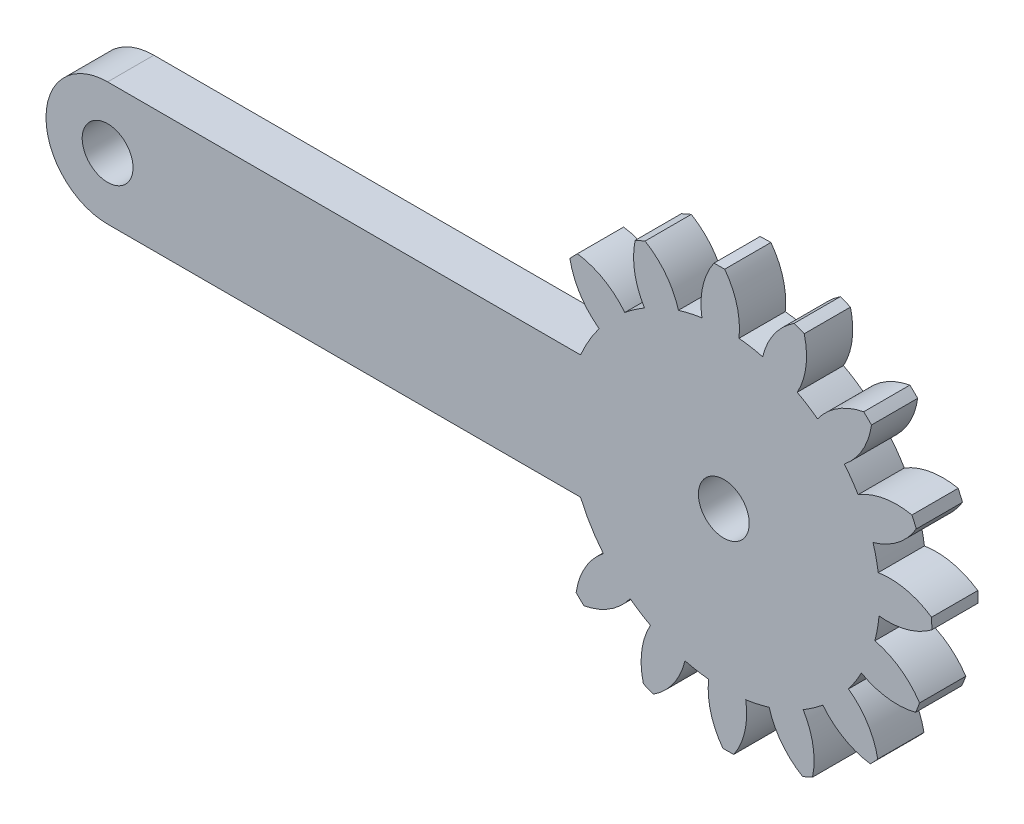
from build123d import *

# Parameters (mm, degrees)
SKETCH1_R           = 1.65
BOSS_EXTRUDE1_DEPTH = 3


with BuildPart() as part:
    # Sketch1 → Boss-Extrude1 (new body)
    with BuildSketch(Plane.XY):
        with BuildLine():
            ThreePointArc((-20.755142163, -16.478801884), (-21.932583818, -17.847935828), (-22.52081897, -19.555236625))
            ThreePointArc((-22.52081897, -19.555236625), (-22.269390429, -19.802297923), (-22.01159712, -20.042710497))
            ThreePointArc((-22.01159712, -20.042710497), (-20.331579752, -19.3805638), (-19.015108204, -18.144522024))
            ThreePointArc((-19.015108204, -18.144522024), (-18.373585411, -18.588879433), (-17.699741584, -18.98250298))
            ThreePointArc((-17.699741584, -18.98250298), (-18.263610953, -20.698005222), (-18.153713641, -22.500453331))
            ThreePointArc((-18.153713641, -22.500453331), (-17.826877693, -22.63249067), (-17.496705822, -22.755949699))
            ThreePointArc((-17.496705822, -22.755949699), (-16.197964732, -21.501291105), (-15.454716323, -19.855545556))
            ThreePointArc((-15.454716323, -19.855545556), (-14.691978327, -20.020578127), (-13.918794597, -20.126369997))
            ThreePointArc((-13.918794597, -20.126369997), (-13.78324768, -21.927070872), (-12.991948773, -23.550259908))
            ThreePointArc((-12.991948773, -23.550259908), (-12.639463228, -23.547171801), (-12.287178469, -23.534881765))
            ThreePointArc((-12.287178469, -23.534881765), (-11.567435216, -21.878721672), (-11.510562778, -20.073822192))
            ThreePointArc((-11.510562778, -20.073822192), (-10.742729525, -19.934405211), (-9.987916106, -19.736259551))
            ThreePointArc((-9.987916106, -19.736259551), (-9.173588692, -21.348018674), (-7.821356276, -22.544832821))
            ThreePointArc((-7.821356276, -22.544832821), (-7.496883863, -22.407089403), (-7.176118378, -22.260921351))
            ThreePointArc((-7.176118378, -22.260921351), (-7.144947346, -20.455395119), (-7.783109193, -18.766121291))
            ThreePointArc((-7.783109193, -18.766121291), (-7.127076334, -18.343479732), (-6.505546727, -17.871562422))
            ThreePointArc((-6.505546727, -17.871562422), (-5.136412783, -19.049004077), (-3.429111986, -19.637239229))
            ThreePointArc((-3.429111986, -19.637239229), (-3.182050688, -19.385810688), (-2.941638114, -19.128017379))
            ThreePointArc((-2.941638114, -19.128017379), (-3.603784812, -17.448000011), (-4.839826587, -16.131528463))
            ThreePointArc((-4.839826587, -16.131528463), (-4.395469179, -15.49000567), (-4.001845631, -14.816161843))
            ThreePointArc((-4.001845631, -14.816161843), (-2.286343389, -15.380031212), (-0.48389528, -15.2701339))
            ThreePointArc((-0.48389528, -15.2701339), (-0.351857941, -14.943297952), (-0.228398912, -14.613126081))
            ThreePointArc((-0.228398912, -14.613126081), (-1.483057507, -13.314384991), (-3.128803055, -12.571136582))
            ThreePointArc((-3.128803055, -12.571136582), (-2.963770485, -11.808398586), (-2.857978614, -11.035214856))
            ThreePointArc((-2.857978614, -11.035214856), (-1.05727774, -10.899667939), (0.565911297, -10.108369033))
            ThreePointArc((0.565911297, -10.108369033), (0.56282319, -9.755883487), (0.550533154, -9.403598729))
            ThreePointArc((0.550533154, -9.403598729), (-1.105626939, -8.683855475), (-2.910526419, -8.626983037))
            ThreePointArc((-2.910526419, -8.626983037), (-3.0499434, -7.859149784), (-3.24808906, -7.104336365))
            ThreePointArc((-3.24808906, -7.104336365), (-1.636329937, -6.290008951), (-0.43951579, -4.937776535))
            ThreePointArc((-0.43951579, -4.937776535), (-0.577259208, -4.613304122), (-0.723427261, -4.292538637))
            ThreePointArc((-0.723427261, -4.292538637), (-2.528953492, -4.261367605), (-4.21822732, -4.899529452))
            ThreePointArc((-4.21822732, -4.899529452), (-4.64086888, -4.243496594), (-5.112786189, -3.621966986))
            ThreePointArc((-5.112786189, -3.621966986), (-3.935344534, -2.252833042), (-3.347109382, -0.545532245))
            ThreePointArc((-3.347109382, -0.545532245), (-3.598537923, -0.298470947), (-3.856331232, -0.058058373))
            ThreePointArc((-3.856331232, -0.058058373), (-5.5363486, -0.720205071), (-6.852820148, -1.956246846))
            ThreePointArc((-6.852820148, -1.956246846), (-7.494342941, -1.511889438), (-8.168186768, -1.11826589))
            ThreePointArc((-8.168186768, -1.11826589), (-7.604317399, 0.597236351), (-7.714214711, 2.399684461))
            ThreePointArc((-7.714214711, 2.399684461), (-8.041050659, 2.5317218), (-8.37122253, 2.655180829))
            ThreePointArc((-8.37122253, 2.655180829), (-9.66996362, 1.400522234), (-10.413212029, -0.245223314))
            ThreePointArc((-10.413212029, -0.245223314), (-11.175950025, -0.080190744), (-11.949133755, 0.025601127))
            ThreePointArc((-11.949133755, 0.025601127), (-12.084680673, 1.826302001), (-12.875979579, 3.449491038))
            ThreePointArc((-12.875979579, 3.449491038), (-13.228465124, 3.44640293), (-13.580749883, 3.434112895))
            ThreePointArc((-13.580749883, 3.434112895), (-14.300493136, 1.777952801), (-14.357365574, -0.026946679))
            ThreePointArc((-14.357365574, -0.026946679), (-15.125198828, -0.166363659), (-15.880012246, -0.364509319))
            ThreePointArc((-15.880012246, -0.364509319), (-16.69433966, 1.247249804), (-18.046572076, 2.444063951))
            ThreePointArc((-18.046572076, 2.444063951), (-18.371044489, 2.306320533), (-18.691809974, 2.16015248))
            ThreePointArc((-18.691809974, 2.16015248), (-18.722981006, 0.354626248), (-18.084819159, -1.334647579))
            ThreePointArc((-18.084819159, -1.334647579), (-18.740852018, -1.757289139), (-19.362381625, -2.229206448))
            ThreePointArc((-19.362381625, -2.229206448), (-20.731515569, -1.051764793), (-22.438816366, -0.463529641))
            ThreePointArc((-22.438816366, -0.463529641), (-22.685877664, -0.714958182), (-22.926290238, -0.972751491))
            ThreePointArc((-22.926290238, -0.972751491), (-22.264143541, -2.652768859), (-21.028101765, -3.969240407))
            ThreePointArc((-21.028101765, -3.969240407), (-21.69320555, -4.973863328), (-22.234253204, -6.050384435))
            Line((-22.234253204, -6.050384435), (-52.933964176, -6.050384435))
            ThreePointArc((-52.933964176, -6.050384435), (-56.933964176, -10.050384435), (-52.933964176, -14.050384435))
            Line((-52.933964176, -14.050384435), (-22.234253204, -14.050384435))
            ThreePointArc((-22.234253204, -14.050384435), (-21.580377364, -15.316779311), (-20.755142163, -16.478801884))
        make_face()
        with Locations((-12.933964176, -10.050384435)):
            Circle(SKETCH1_R, mode=Mode.SUBTRACT)
        with Locations((-52.933964176, -10.050384435)):
            Circle(SKETCH1_R, mode=Mode.SUBTRACT)
    extrude(amount=BOSS_EXTRUDE1_DEPTH)


solid = part.part
